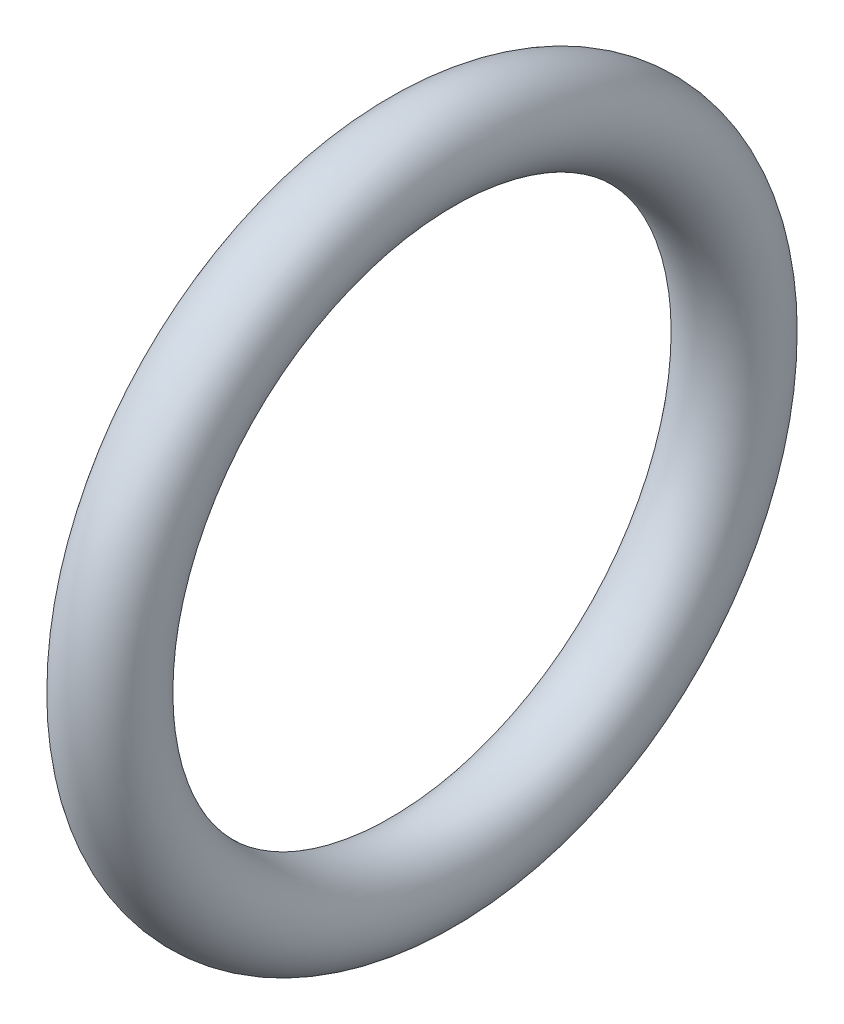
from build123d import *

# Parameters (mm, degrees)
SKETCH_1_R = 0.5


with BuildPart() as part:
    # 草图1 → 旋转1 (revolve)
    with BuildSketch(Plane.XY, mode=Mode.PRIVATE) as revolve_1_sk:
        with Locations((0, 3.5)):
            Circle(SKETCH_1_R)
    revolve(revolve_1_sk.sketch.rotate(Axis((0, 0, 0), (1, 0, 0)), 90), axis=Axis((0, 0, 0), (1, 0, 0)))


solid = part.part
